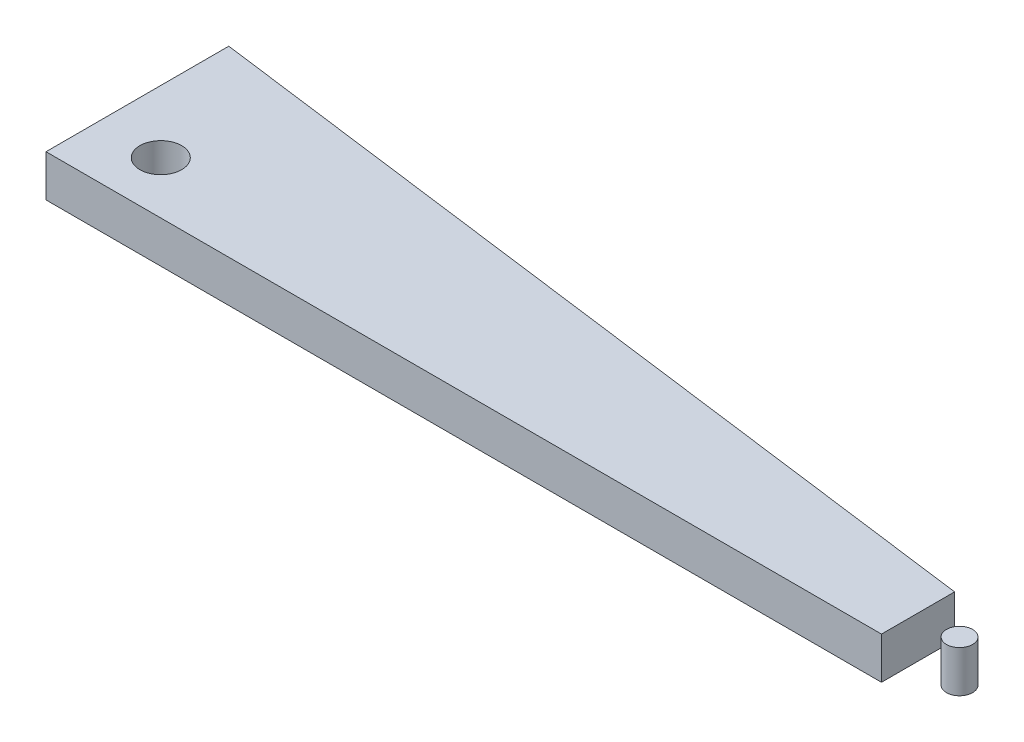
from build123d import *

# Parameters (mm, degrees)
SKETCH1_R             = 2.5
BOSS_EXTRUDE1_DEPTH   = 8
SKETCH1_R_2           = 4
BOSS_EXTRUDE1_2_DEPTH = 8


with BuildPart() as part:
    # Sketch1 → Boss-Extrude1 (new body)
    with BuildSketch(Plane(origin=(0, 0, 0), x_dir=(1, 0, 0), z_dir=(0, 1, 0))):
        with Locations(Location((167.947390468, 7, 0), (0, 0, 270))):
            Circle(SKETCH1_R)
    extrude(amount=BOSS_EXTRUDE1_DEPTH)


with BuildPart() as body_2:
    # Sketch1 → Boss-Extrude1 2 (new body)
    with BuildSketch(Plane(origin=(0, 0, 0), x_dir=(1, 0, 0), z_dir=(0, 1, 0))):
        Polygon((0, 0), (160, 0), (160, 14), (0, 35), align=None)
        with Locations(Location((11.978896163, 10, 0), (0, 0, 270))):
            Circle(SKETCH1_R_2, mode=Mode.SUBTRACT)
    extrude(amount=BOSS_EXTRUDE1_2_DEPTH)


solid = Compound([part.part, body_2.part])
